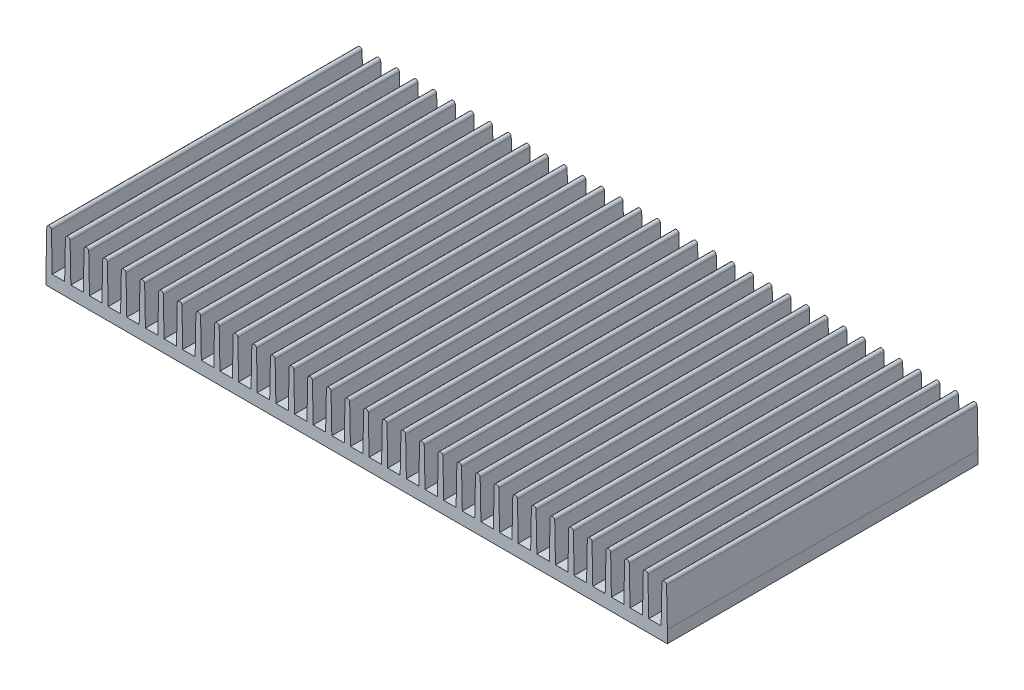
from build123d import *

# Parameters (mm, degrees)
EXTRUDE_2_DEPTH     = 100
SKETCH_1_R          = 2
CUT_EXTRUDE_1_DEPTH = 143.439460825
SKETCH_2_R          = 2
CUT_EXTRUDE_2_DEPTH = 143.439460825


with BuildPart() as part:
    # 17F200L100 → ﾎﾞｽ - 押し出し2 (new body)
    with BuildSketch(Plane.XY):
        with BuildLine():
            Line((-98, 4), (-94, 4))
            Line((-94, 4), (-93.749844059, 16.265293393))
            ThreePointArc((-93.749844059, 16.265293393), (-93, 17), (-92.250155941, 16.265293393))
            Line((-92.250155941, 16.265293393), (-92, 4))
            Line((-92, 4), (-88, 4))
            Line((-88, 4), (-87.749844059, 16.265293393))
            ThreePointArc((-87.749844059, 16.265293393), (-87, 17), (-86.250155941, 16.265293393))
            Line((-86.250155941, 16.265293393), (-86, 4))
            Line((-86, 4), (-82, 4))
            Line((-82, 4), (-81.749844059, 16.265293393))
            ThreePointArc((-81.749844059, 16.265293393), (-81, 17), (-80.250155941, 16.265293393))
            Line((-80.250155941, 16.265293393), (-80, 4))
            Line((-80, 4), (-76, 4))
            Line((-76, 4), (-75.749844059, 16.265293393))
            ThreePointArc((-75.749844059, 16.265293393), (-75, 17), (-74.250155941, 16.265293393))
            Line((-74.250155941, 16.265293393), (-74, 4))
            Line((-74, 4), (-70, 4))
            Line((-70, 4), (-69.749844059, 16.265293393))
            ThreePointArc((-69.749844059, 16.265293393), (-69, 17), (-68.250155941, 16.265293393))
            Line((-68.250155941, 16.265293393), (-68, 4))
            Line((-68, 4), (-64, 4))
            Line((-64, 4), (-63.749844059, 16.265293393))
            ThreePointArc((-63.749844059, 16.265293393), (-63, 17), (-62.250155941, 16.265293393))
            Line((-62.250155941, 16.265293393), (-62, 4))
            Line((-62, 4), (-58, 4))
            Line((-58, 4), (-57.749844059, 16.265293393))
            ThreePointArc((-57.749844059, 16.265293393), (-57, 17), (-56.250155941, 16.265293393))
            Line((-56.250155941, 16.265293393), (-56, 4))
            Line((-56, 4), (-52, 4))
            Line((-52, 4), (-51.749844059, 16.265293393))
            ThreePointArc((-51.749844059, 16.265293393), (-51, 17), (-50.250155941, 16.265293393))
            Line((-50.250155941, 16.265293393), (-50, 4))
            Line((-50, 4), (-46, 4))
            Line((-46, 4), (-45.749844059, 16.265293393))
            ThreePointArc((-45.749844059, 16.265293393), (-45, 17), (-44.250155941, 16.265293393))
            Line((-44.250155941, 16.265293393), (-44, 4))
            Line((-44, 4), (-40, 4))
            Line((-40, 4), (-39.749844059, 16.265293393))
            ThreePointArc((-39.749844059, 16.265293393), (-39, 17), (-38.250155941, 16.265293393))
            Line((-38.250155941, 16.265293393), (-38, 4))
            Line((-38, 4), (-34, 4))
            Line((-34, 4), (-33.749844059, 16.265293393))
            ThreePointArc((-33.749844059, 16.265293393), (-33, 17), (-32.250155941, 16.265293393))
            Line((-32.250155941, 16.265293393), (-32, 4))
            Line((-32, 4), (-28, 4))
            Line((-28, 4), (-27.749844059, 16.265293393))
            ThreePointArc((-27.749844059, 16.265293393), (-27, 17), (-26.250155941, 16.265293393))
            Line((-26.250155941, 16.265293393), (-26, 4))
            Line((-26, 4), (-22, 4))
            Line((-22, 4), (-21.749844059, 16.265293393))
            ThreePointArc((-21.749844059, 16.265293393), (-21, 17), (-20.250155941, 16.265293393))
            Line((-20.250155941, 16.265293393), (-20, 4))
            Line((-20, 4), (-16, 4))
            Line((-16, 4), (-15.749844059, 16.265293393))
            ThreePointArc((-15.749844059, 16.265293393), (-15, 17), (-14.250155941, 16.265293393))
            Line((-14.250155941, 16.265293393), (-14, 4))
            Line((-14, 4), (-10, 4))
            Line((-10, 4), (-9.749844059, 16.265293393))
            ThreePointArc((-9.749844059, 16.265293393), (-9, 17), (-8.250155941, 16.265293393))
            Line((-8.250155941, 16.265293393), (-8, 4))
            Line((-8, 4), (-4, 4))
            Line((-4, 4), (-3.749844059, 16.265293393))
            ThreePointArc((-3.749844059, 16.265293393), (-3, 17), (-2.250155941, 16.265293393))
            Line((-2.250155941, 16.265293393), (-2, 4))
            Line((-2, 4), (2, 4))
            Line((2, 4), (2.250155941, 16.265293393))
            ThreePointArc((2.250155941, 16.265293393), (3, 17), (3.749844059, 16.265293393))
            Line((3.749844059, 16.265293393), (4, 4))
            Line((4, 4), (8, 4))
            Line((8, 4), (8.250155941, 16.265293393))
            ThreePointArc((8.250155941, 16.265293393), (9, 17), (9.749844059, 16.265293393))
            Line((9.749844059, 16.265293393), (10, 4))
            Line((10, 4), (14, 4))
            Line((14, 4), (14.250155941, 16.265293393))
            ThreePointArc((14.250155941, 16.265293393), (15, 17), (15.749844059, 16.265293393))
            Line((15.749844059, 16.265293393), (16, 4))
            Line((16, 4), (20, 4))
            Line((20, 4), (20.250155941, 16.265293393))
            ThreePointArc((20.250155941, 16.265293393), (21, 17), (21.749844059, 16.265293393))
            Line((21.749844059, 16.265293393), (22, 4))
            Line((22, 4), (26, 4))
            Line((26, 4), (26.250155941, 16.265293393))
            ThreePointArc((26.250155941, 16.265293393), (27, 17), (27.749844059, 16.265293393))
            Line((27.749844059, 16.265293393), (28, 4))
            Line((28, 4), (32, 4))
            Line((32, 4), (32.250155941, 16.265293393))
            ThreePointArc((32.250155941, 16.265293393), (33, 17), (33.749844059, 16.265293393))
            Line((33.749844059, 16.265293393), (34, 4))
            Line((34, 4), (38, 4))
            Line((38, 4), (38.250155941, 16.265293393))
            ThreePointArc((38.250155941, 16.265293393), (39, 17), (39.749844059, 16.265293393))
            Line((39.749844059, 16.265293393), (40, 4))
            Line((40, 4), (44, 4))
            Line((44, 4), (44.250155941, 16.265293393))
            ThreePointArc((44.250155941, 16.265293393), (45, 17), (45.749844059, 16.265293393))
            Line((45.749844059, 16.265293393), (46, 4))
            Line((46, 4), (50, 4))
            Line((50, 4), (50.250155941, 16.265293393))
            ThreePointArc((50.250155941, 16.265293393), (51, 17), (51.749844059, 16.265293393))
            Line((51.749844059, 16.265293393), (52, 4))
            Line((52, 4), (56, 4))
            Line((56, 4), (56.250155941, 16.265293393))
            ThreePointArc((56.250155941, 16.265293393), (57, 17), (57.749844059, 16.265293393))
            Line((57.749844059, 16.265293393), (58, 4))
            Line((58, 4), (62, 4))
            Line((62, 4), (62.250155941, 16.265293393))
            ThreePointArc((62.250155941, 16.265293393), (63, 17), (63.749844059, 16.265293393))
            Line((63.749844059, 16.265293393), (64, 4))
            Line((64, 4), (68, 4))
            Line((68, 4), (68.250155941, 16.265293393))
            ThreePointArc((68.250155941, 16.265293393), (69, 17), (69.749844059, 16.265293393))
            Line((69.749844059, 16.265293393), (70, 4))
            Line((70, 4), (74, 4))
            Line((74, 4), (74.250155941, 16.265293393))
            ThreePointArc((74.250155941, 16.265293393), (75, 17), (75.749844059, 16.265293393))
            Line((75.749844059, 16.265293393), (76, 4))
            Line((76, 4), (80, 4))
            Line((80, 4), (80.250155941, 16.265293393))
            ThreePointArc((80.250155941, 16.265293393), (81, 17), (81.749844059, 16.265293393))
            Line((81.749844059, 16.265293393), (82, 4))
            Line((82, 4), (86, 4))
            Line((86, 4), (86.250155941, 16.265293393))
            ThreePointArc((86.250155941, 16.265293393), (87, 17), (87.749844059, 16.265293393))
            Line((87.749844059, 16.265293393), (88, 4))
            Line((88, 4), (92, 4))
            Line((92, 4), (92.250155941, 16.265293393))
            ThreePointArc((92.250155941, 16.265293393), (93, 17), (93.749844059, 16.265293393))
            Line((93.749844059, 16.265293393), (94, 4))
            Line((94, 4), (98, 4))
            Line((98, 4), (98.250155941, 16.265293393))
            ThreePointArc((98.250155941, 16.265293393), (99, 17), (99.749844059, 16.265293393))
            Line((99.749844059, 16.265293393), (100, 4))
            Line((100, 4), (100, 0))
            Line((100, 0), (-100, 0))
            Line((-100, 0), (-100, 4))
            Line((-100, 4), (-99.749844059, 16.265293393))
            ThreePointArc((-99.749844059, 16.265293393), (-99, 17), (-98.250155941, 16.265293393))
            Line((-98.250155941, 16.265293393), (-98, 4))
        make_face()
    extrude(amount=EXTRUDE_2_DEPTH)

    # ｽｹｯﾁ1 → ｶｯﾄ - 押し出し1 (cut, through all)
    with BuildSketch(Plane.XZ):
        with Locations(Location((-78, 50, 0), (0, 0, 270))):
            Circle(SKETCH_1_R)
        with Locations(Location((90, 50, 0), (0, 0, 270))):
            Circle(SKETCH_1_R)
    extrude(amount=-CUT_EXTRUDE_1_DEPTH, mode=Mode.SUBTRACT)

    # ｽｹｯﾁ2 → ｶｯﾄ - 押し出し2 (cut, through all)
    with BuildSketch(Plane(origin=(0, 0, 0), x_dir=(-1, 0, 0), z_dir=(0, -1, 0))):
        with Locations(Location((48, -85, 0), (0, 0, 90))):
            Circle(SKETCH_2_R)
        with Locations(Location((48, -15, 0), (0, 0, 90))):
            Circle(SKETCH_2_R)
        with Locations(Location((90, -85, 0), (0, 0, 90))):
            Circle(SKETCH_2_R)
        with Locations(Location((90, -15, 0), (0, 0, 90))):
            Circle(SKETCH_2_R)
    extrude(amount=-CUT_EXTRUDE_2_DEPTH, mode=Mode.SUBTRACT)


solid = part.part
